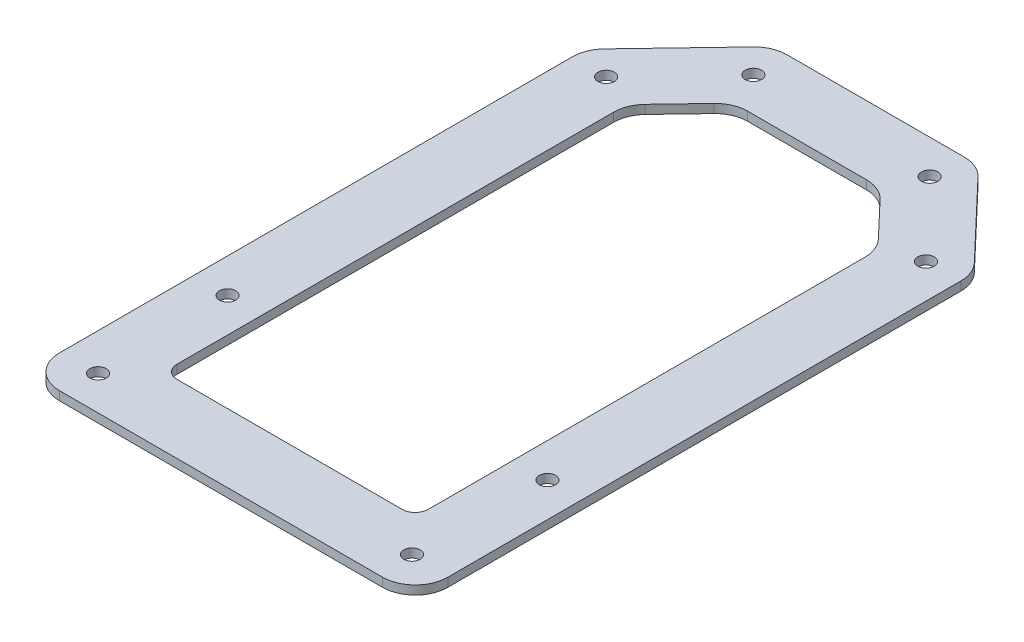
from build123d import *

# Parameters (mm, degrees)
SKETCH3_R           = 1.25
BOSS_EXTRUDE1_DEPTH = 1.35
FILLET1_R           = 5
FILLET2_R           = 2


with BuildPart() as part:
    # Sketch3 → Boss-Extrude1 (new body)
    with BuildSketch(Plane(origin=(0, 0, 0), x_dir=(1, 0, 0), z_dir=(0, 1, 0))):
        Polygon((-29.75, -55.35), (29.75, -55.35), (29.75, 30.244309853), (15.751559249, 44.95), (-15.731542027, 44.95), (-29.75, 30.263390376), align=None)
        with Locations(Location((13.515, 39.7, 0), (0, 0, 270))):
            Circle(SKETCH3_R, mode=Mode.SUBTRACT)
        with Locations(Location((-13.485, 39.7, 0), (0, 0, 270))):
            Circle(SKETCH3_R, mode=Mode.SUBTRACT)
        with Locations(Location((-24.5, 28.16, 0), (0, 0, 270))):
            Circle(SKETCH3_R, mode=Mode.SUBTRACT)
        with Locations(Location((-24.5, -29.84, 0), (0, 0, 270))):
            Circle(SKETCH3_R, mode=Mode.SUBTRACT)
        with Locations(Location((-24.085, -50.1, 0), (0, 0, 270))):
            Circle(SKETCH3_R, mode=Mode.SUBTRACT)
        with Locations(Location((24.5, -29.84, 0), (0, 0, 270))):
            Circle(SKETCH3_R, mode=Mode.SUBTRACT)
        with Locations(Location((24.015, -50.1, 0), (0, 0, 270))):
            Circle(SKETCH3_R, mode=Mode.SUBTRACT)
        with Locations(Location((24.5, 28.16, 0), (0, 0, 270))):
            Circle(SKETCH3_R, mode=Mode.SUBTRACT)
        Polygon((-19.25, -44.85), (19.25, -44.85), (19.25, 26.045705114), (11.249897805, 34.45), (-11.238457973, 34.45), (-19.25, 26.056609624), align=None, mode=Mode.SUBTRACT)
    extrude(amount=-BOSS_EXTRUDE1_DEPTH)

    # Fillet1
    fillet1_edges = [part.edges().sort_by_distance(p)[0] for p in [
        (29.75, -0.675, 55.35),
        (-29.75, -0.675, 55.35),
        (-29.75, -0.675, -30.263390376),
        (-15.731542027, -0.675, -44.95),
        (15.751559249, -0.675, -44.95),
        (29.75, -0.675, -30.244309853),
        (19.25, -0.675, -26.045705114),
        (-19.25, -0.675, -26.056609624),
        (-11.238457973, -0.675, -34.45),
        (11.249897805, -0.675, -34.45),
    ]]
    fillet(fillet1_edges, radius=FILLET1_R)

    # Fillet2
    fillet2_edges = [part.edges().sort_by_distance(p)[0] for p in [
        (19.25, -0.675, 44.85),
        (-19.25, -0.675, 44.85),
    ]]
    fillet(fillet2_edges, radius=FILLET2_R)


solid = part.part
